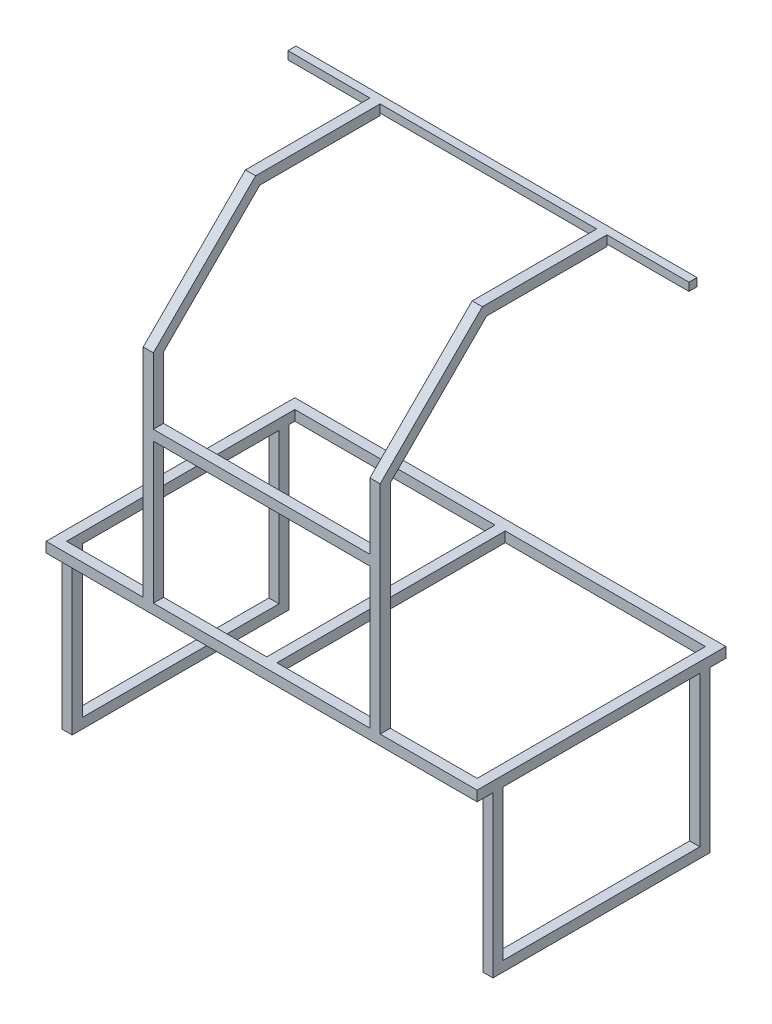
from build123d import *

# Parameters (mm, degrees)
SKETCH1_W           = 1074.6
SKETCH1_H           = 620
SKETCH1_W_2         = 1023.8
SKETCH1_H_2         = 569.2
BOSS_EXTRUDE1_DEPTH = 25.4
SKETCH2_W           = 25.4
SKETCH2_H           = 25.4
BOSS_EXTRUDE2_DEPTH = 400
SKETCH3_W           = 25.4
SKETCH3_H           = 25.4
BOSS_EXTRUDE3_DEPTH = 490.4
SKETCH5_W           = 25.4
SKETCH5_H           = 25.4
BOSS_EXTRUDE5_DEPTH = 50
SKETCH4_W           = 25.4
SKETCH4_H           = 569.2
BOSS_EXTRUDE6_DEPTH = 25.4
BOSS_EXTRUDE7_DEPTH = 25.4
SKETCH9_W           = 25.4
SKETCH9_H           = 25.4
BOSS_EXTRUDE8_DEPTH = 270
SKETCH10_W          = 1000
SKETCH10_H          = 20
BOSS_EXTRUDE9_DEPTH = 20


with BuildPart() as part:
    # Sketch1 → Boss-Extrude1 (new body)
    with BuildSketch(Plane(origin=(0, 0, 0), x_dir=(1, 0, 0), z_dir=(0, 1, 0))):
        Rectangle(SKETCH1_W, SKETCH1_H)
        Rectangle(SKETCH1_W_2, SKETCH1_H_2, mode=Mode.SUBTRACT)
    extrude(amount=BOSS_EXTRUDE1_DEPTH)

    # Sketch2 → Boss-Extrude2 (add)
    with BuildSketch(Plane.XZ):
        with Locations((-524.6, 257.9)):
            Rectangle(SKETCH2_W, SKETCH2_H)
        with Locations((-524.6, -257.9)):
            Rectangle(SKETCH2_W, SKETCH2_H)
        with Locations((524.6, 257.9)):
            Rectangle(SKETCH2_W, SKETCH2_H)
        with Locations((524.6, -257.9)):
            Rectangle(SKETCH2_W, SKETCH2_H)
    extrude(amount=BOSS_EXTRUDE2_DEPTH)

    # Sketch3 → Boss-Extrude3 (add)
    with BuildSketch(Plane(origin=(0, 0, 245.2), x_dir=(-1, 0, 0), z_dir=(0, 0, -1))):
        with Locations((524.6, -387.3)):
            Rectangle(SKETCH3_W, SKETCH3_H)
        with Locations((-524.6, -387.3)):
            Rectangle(SKETCH3_W, SKETCH3_H)
    extrude(amount=BOSS_EXTRUDE3_DEPTH)

    # Sketch5 → Boss-Extrude5 (add)
    with BuildSketch(Plane(origin=(0, 25.4, 0), x_dir=(1, 0, 0), z_dir=(0, 1, 0))):
        with Locations((282.7, -297.3)):
            Rectangle(SKETCH5_W, SKETCH5_H)
    boss_extrude5 = extrude(amount=BOSS_EXTRUDE5_DEPTH)

    # Sketch4 → Boss-Extrude6 (add)
    with BuildSketch(Plane(origin=(0, 25.4, 0), x_dir=(1, 0, 0), z_dir=(0, 1, 0))):
        Rectangle(SKETCH4_W, SKETCH4_H)
    extrude(amount=-BOSS_EXTRUDE6_DEPTH)

    # Sketch8 → Boss-Extrude7 (add)
    with BuildSketch(Plane(origin=(295.4, 0, 0), x_dir=(0, 0, -1), z_dir=(1, 0, 0))):
        Polygon((-284.6, 75.4), (-284.6, 555.4), (-44.6, 795.4), (255.4, 795.4), (255.4, 820.8), (-55.121024484, 820.8), (-310, 565.921024484), (-310, 75.4), align=None)
    boss_extrude7 = extrude(amount=-BOSS_EXTRUDE7_DEPTH)

    # Sketch9 → Boss-Extrude8 (add)
    with BuildSketch(Plane.ZY.offset(-270)):
        with Locations((297.3, 388.1)):
            Rectangle(SKETCH9_W, SKETCH9_H)
    boss_extrude8 = extrude(amount=BOSS_EXTRUDE8_DEPTH)

    # Mirror1: Boss-Extrude5, Boss-Extrude7, Boss-Extrude8 across plane
    add(boss_extrude5.mirror(Plane.ZY))
    add(boss_extrude7.mirror(Plane.ZY))
    add(boss_extrude8.mirror(Plane.ZY))

    # Sketch10 → Boss-Extrude9 (add)
    with BuildSketch(Plane(origin=(0, 820.8, 0), x_dir=(1, 0, 0), z_dir=(0, 1, 0))):
        with Locations((0, 265.4)):
            Rectangle(SKETCH10_W, SKETCH10_H)
    extrude(amount=-BOSS_EXTRUDE9_DEPTH)


solid = part.part
